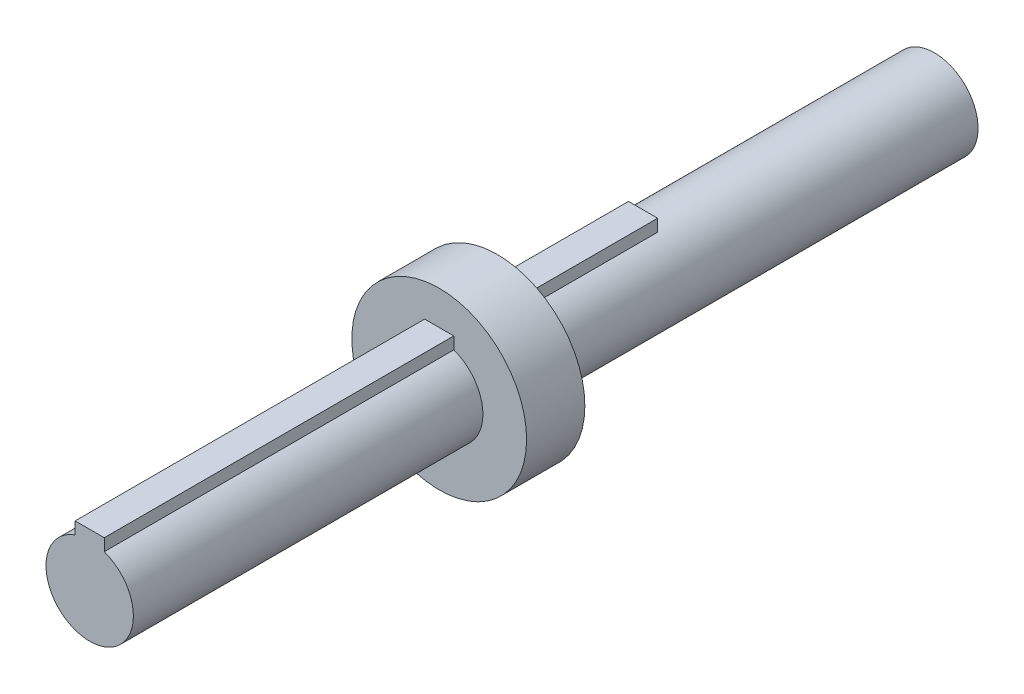
from build123d import *

# Parameters (mm, degrees)
BOSS_EXTRUDE1_DEPTH = 800
SKETCH3_R           = 30
BOSS_EXTRUDE3_DEPTH = 20
SKETCH4_R           = 30
CUT_EXTRUDE1_DEPTH  = 1391.647331281
SKETCH5_R           = 15
BOSS_EXTRUDE4_DEPTH = 100
SKETCH6_R           = 30
CUT_EXTRUDE2_DEPTH  = 20
BOSS_EXTRUDE5_START = -140
SKETCH7_R           = 30
BOSS_EXTRUDE5_DEPTH = 20


with BuildPart() as part:
    # Sketch1 → Boss-Extrude1 (new, symmetric)
    with BuildSketch(Plane.XY):
        with BuildLine():
            Line((-5, 14.142135624), (-5, 18.3))
            Line((-5, 18.3), (5, 18.3))
            Line((5, 18.3), (5, 14.142135624))
            ThreePointArc((5, 14.142135624), (0, -15), (-5, 14.142135624))
        make_face()
    extrude(amount=BOSS_EXTRUDE1_DEPTH, both=True)

    # Sketch3 → Boss-Extrude3 (add)
    with BuildSketch(Plane(origin=(0, 0, 590), x_dir=(-1, 0, 0), z_dir=(0, 0, -1))):
        Circle(SKETCH3_R)
    boss_extrude3 = extrude(amount=-BOSS_EXTRUDE3_DEPTH)

    # Mirror2: Boss-Extrude3 across plane
    add(boss_extrude3.mirror(Plane.XY))

    # Sketch4 → Cut-Extrude1 (cut, through all)
    with BuildSketch(Plane.XY.offset(-590)):
        with Locations(Location((0, 0, 0), (0, 0, 180))):
            Circle(SKETCH4_R)
    extrude(amount=CUT_EXTRUDE1_DEPTH, mode=Mode.SUBTRACT)

    # Sketch5 → Boss-Extrude4 (add)
    with BuildSketch(Plane(origin=(0, 0, -800), x_dir=(-1, 0, 0), z_dir=(0, 0, -1))):
        Circle(SKETCH5_R)
    extrude(amount=BOSS_EXTRUDE4_DEPTH)

    # Sketch6 → Cut-Extrude2 (cut)
    with BuildSketch(Plane.XY.offset(-590)):
        Circle(SKETCH6_R)
    extrude(amount=-CUT_EXTRUDE2_DEPTH, mode=Mode.SUBTRACT)

    # Sketch7 → Boss-Extrude5 (add)
    with BuildSketch(Plane.XY.offset(-610).offset(BOSS_EXTRUDE5_START)):
        Circle(SKETCH7_R)
    extrude(amount=BOSS_EXTRUDE5_DEPTH)


solid = part.part
